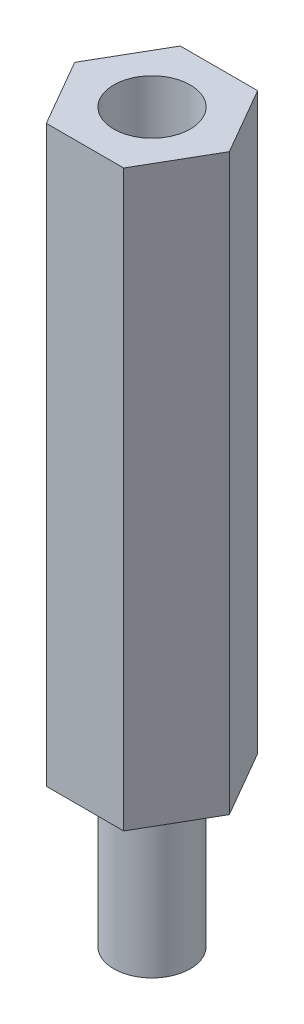
from build123d import *

# Parameters (mm, degrees)
SKETCH_1_R      = 2
EXTRUDE_1_DEPTH = 30
SKETCH_2_R      = 2
EXTRUDE_2_DEPTH = 8


with BuildPart() as part:
    # 草图1 → 凸台-拉伸1 (new body)
    with BuildSketch(Plane(origin=(0, 0, 0), x_dir=(1, 0, 0), z_dir=(0, 1, 0))):
        Polygon((4.041451884, 0), (2.020725942, 3.5), (-2.020725942, 3.5), (-4.041451884, 0), (-2.020725942, -3.5), (2.020725942, -3.5), align=None)
        with Locations(Location((0, 0, 0), (0, 0, 270))):
            Circle(SKETCH_1_R, mode=Mode.SUBTRACT)
    extrude(amount=EXTRUDE_1_DEPTH)


with BuildPart() as body_2:
    # 草图2 → 凸台-拉伸2 (new body)
    with BuildSketch(Plane.XZ):
        with Locations(Location((0, 0, 0), (0, 0, 270))):
            Circle(SKETCH_2_R)
    extrude(amount=EXTRUDE_2_DEPTH)


solid = Compound([part.part, body_2.part])
